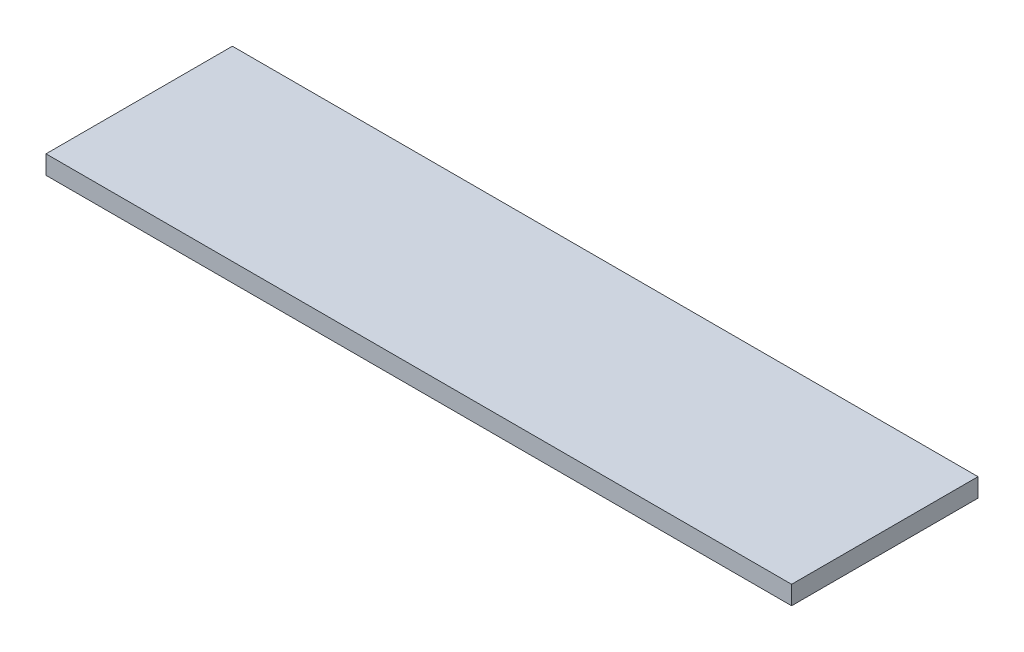
from build123d import *

# Parameters (mm, degrees)
SKETCH1_W           = 120
SKETCH1_H           = 30
BOSS_EXTRUDE1_DEPTH = 3


with BuildPart() as part:
    # Sketch1 → Boss-Extrude1 (new body)
    with BuildSketch(Plane(origin=(0, 0, 0), x_dir=(1, 0, 0), z_dir=(0, 1, 0))):
        Rectangle(SKETCH1_W, SKETCH1_H)
    extrude(amount=BOSS_EXTRUDE1_DEPTH)


solid = part.part
